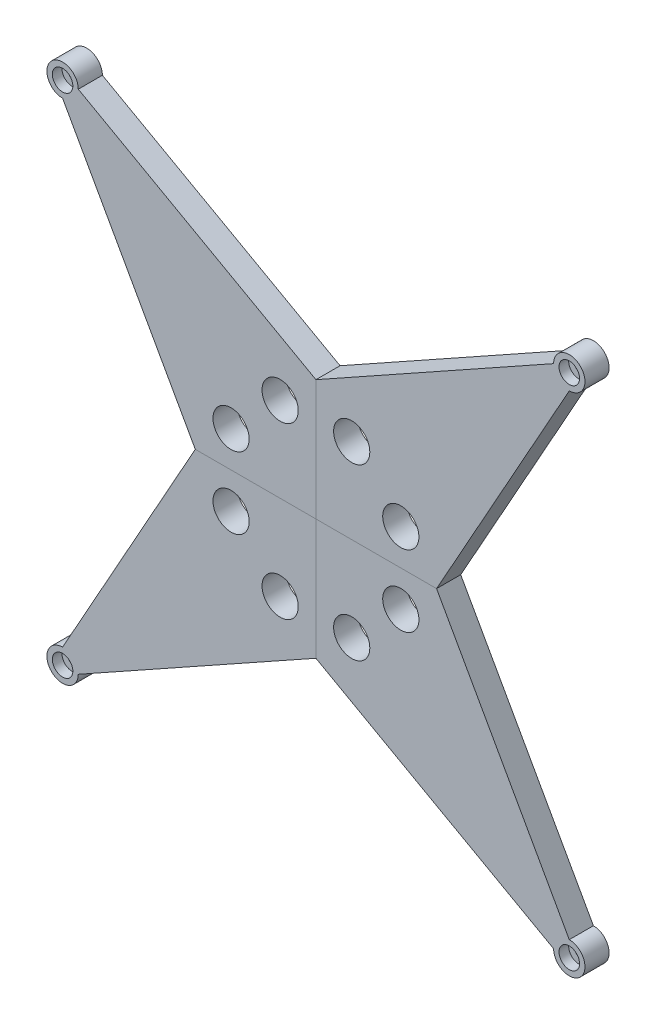
from build123d import *

# Parameters (mm, degrees)
RESSALTO_EXTRUS_O2_DEPTH = 5
ESBO_O4_R                = 4.25
CORTE_EXTRUS_O1_DEPTH    = 4
ESBO_O5_R                = 1.5
CORTE_EXTRUS_O2_DEPTH    = 158.798922683
ESBO_O6_R                = 7.5
CORTE_EXTRUS_O3_DEPTH    = 159.001582271


with BuildPart() as part:
    # Esboço3 → Ressalto-extrusão2 (new, symmetric)
    with BuildSketch(Plane.XY):
        with BuildLine():
            Line((0, 50), (98.5, 105))
            ThreePointArc((98.5, 105), (109.596194078, 109.596194078), (105, 98.5))
            Line((105, 98.5), (50, 0))
            Line((50, 0), (0, 0))
            Line((0, 0), (0, 50))
        make_face()
    extrude(amount=RESSALTO_EXTRUS_O2_DEPTH, both=True)

    # Esboço4 → Corte-extrusão1 (cut)
    with BuildSketch(Plane.XY.offset(5)):
        with Locations((105, 105)):
            Circle(ESBO_O4_R)
    extrude(amount=-CORTE_EXTRUS_O1_DEPTH, mode=Mode.SUBTRACT)

    # Esboço5 → Corte-extrusão2 (cut, through all)
    with BuildSketch(Plane.XY.offset(1)):
        with Locations((105, 105)):
            Circle(ESBO_O5_R)
    extrude(amount=-CORTE_EXTRUS_O2_DEPTH, mode=Mode.SUBTRACT)

    # Esboço6 → Corte-extrusão3 (cut, through all)
    with BuildSketch(Plane.XY.offset(5)):
        with Locations((14.825558834, 35.174441166)):
            Circle(ESBO_O6_R)
        with Locations((35.174441166, 14.825558834)):
            Circle(ESBO_O6_R)
    extrude(amount=-CORTE_EXTRUS_O3_DEPTH, mode=Mode.SUBTRACT)


with BuildPart() as body_2:
    # Espelhar1: mirrored copy
    add(part.part.mirror(Plane(origin=(0, 0, 5), x_dir=(0, 0, 1), z_dir=(0, 1, 0))))


with BuildPart() as body_3:
    # Espelhar2: mirrored copy
    add(body_2.part.mirror(Plane(origin=(0, 0, 5), x_dir=(0, 0, 1), z_dir=(1, 0, 0))))


with BuildPart() as body_4:
    # Espelhar2 2: mirrored copy
    add(part.part.mirror(Plane(origin=(0, 0, 5), x_dir=(0, 0, 1), z_dir=(1, 0, 0))))


solid = Compound([part.part, body_2.part, body_3.part, body_4.part])
